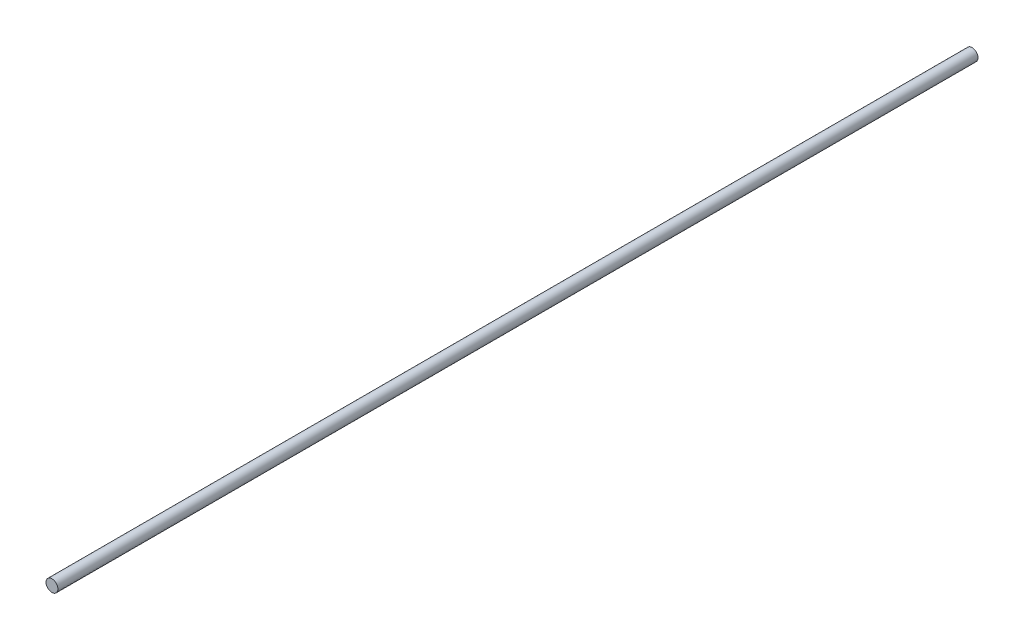
from build123d import *

# Parameters (mm, degrees)
SKETCH1_R           = 1.5875
BOSS_EXTRUDE1_DEPTH = 245.95


with BuildPart() as part:
    # Sketch1 → Boss-Extrude1 (new body)
    with BuildSketch(Plane.XY):
        with Locations(Location((0, 0, 0), (0, 0, 180))):
            Circle(SKETCH1_R)
    extrude(amount=BOSS_EXTRUDE1_DEPTH)


solid = part.part
